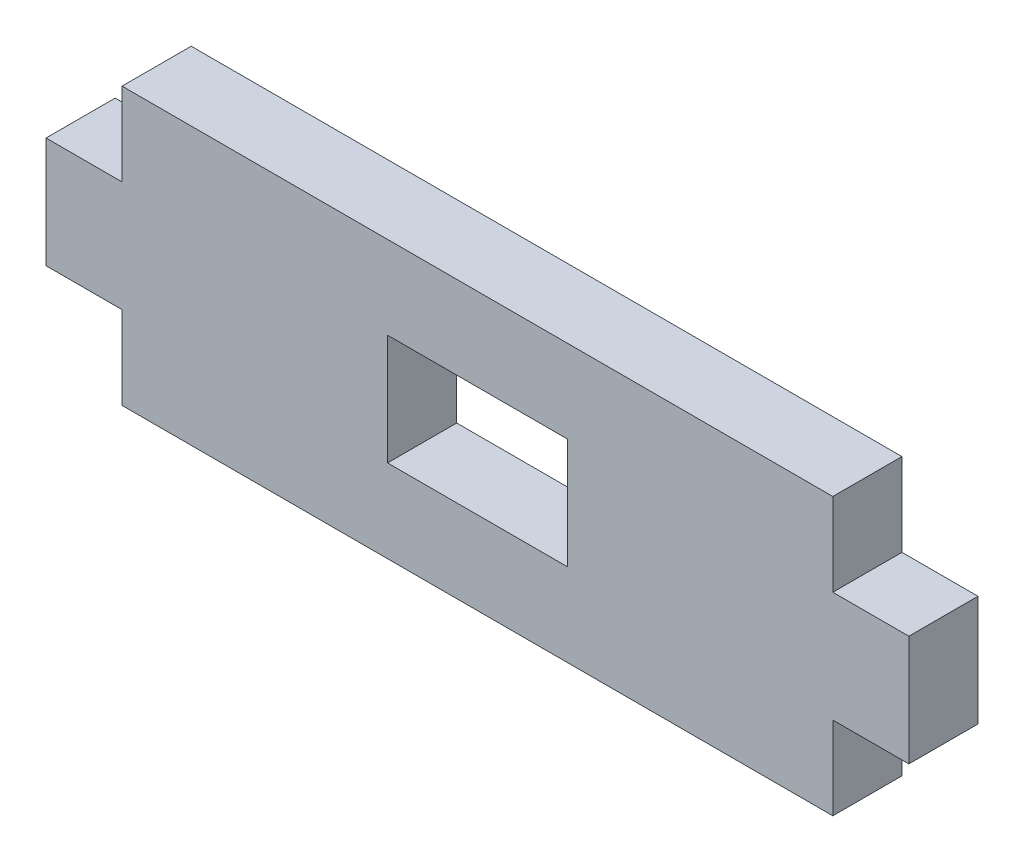
from build123d import *

# Parameters (mm, degrees)
BOSS_EXTRUDE1_DEPTH = 5
SKETCH2_W           = 13
SKETCH2_H           = 8
CUT_EXTRUDE1_DEPTH  = 5


with BuildPart() as part:
    # Sketch1 → Boss-Extrude1 (new body)
    with BuildSketch(Plane.XY):
        Polygon((25.7, 10), (-25.7, 10), (-25.7, 4), (-31.2, 4), (-31.2, -4), (-25.7, -4), (-25.7, -10), (25.7, -10), (25.7, -4), (31.2, -4), (31.2, 4), (25.7, 4), align=None)
    extrude(amount=BOSS_EXTRUDE1_DEPTH)

    # Sketch2 → Cut-Extrude1 (cut)
    with BuildSketch(Plane.XY.offset(5)):
        Rectangle(SKETCH2_W, SKETCH2_H)
    extrude(amount=-CUT_EXTRUDE1_DEPTH, mode=Mode.SUBTRACT)


solid = part.part
